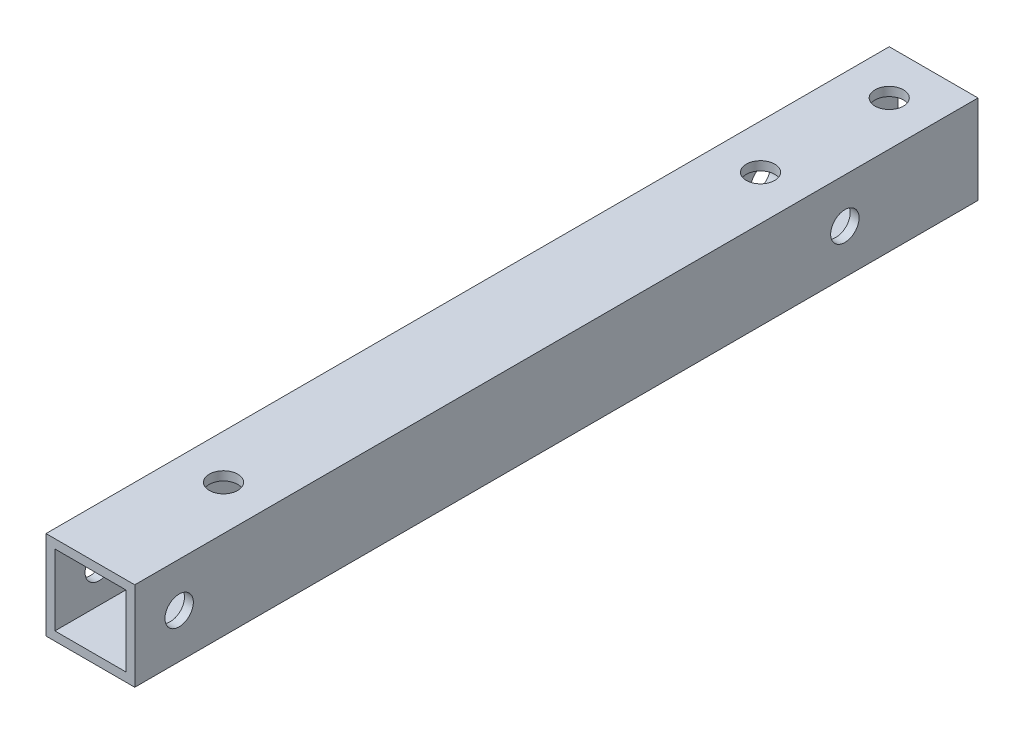
from build123d import *

# Parameters (mm, degrees)
SKETCH_1_W          = 10
SKETCH_1_H          = 10
SKETCH_1_W_2        = 8
SKETCH_1_H_2        = 8
EXTRUDE_1_DEPTH     = 95
SKETCH_2_R          = 1.6
CUT_EXTRUDE_1_DEPTH = 96.655632349
SKETCH_3_R          = 1.6
CUT_EXTRUDE_2_DEPTH = 96.655632349


with BuildPart() as part:
    # ｽｹｯﾁ1 → ﾎﾞｽ - 押し出し1 (new body)
    with BuildSketch(Plane.XY):
        Rectangle(SKETCH_1_W, SKETCH_1_H)
        Rectangle(SKETCH_1_W_2, SKETCH_1_H_2, mode=Mode.SUBTRACT)
    extrude(amount=EXTRUDE_1_DEPTH)

    # ｽｹｯﾁ2 → ｶｯﾄ - 押し出し1 (cut, through all)
    with BuildSketch(Plane(origin=(0, 5, 0), x_dir=(1, 0, 0), z_dir=(0, 1, 0))):
        with Locations(Location((0, -5, 0), (0, 0, 270))):
            Circle(SKETCH_2_R)
        with Locations(Location((0, -80, 0), (0, 0, 270))):
            Circle(SKETCH_2_R)
        with Locations(Location((0, -19.5, 0), (0, 0, 270))):
            Circle(SKETCH_2_R)
    extrude(amount=-CUT_EXTRUDE_1_DEPTH, mode=Mode.SUBTRACT)

    # ｽｹｯﾁ3 → ｶｯﾄ - 押し出し2 (cut, through all)
    with BuildSketch(Plane.ZY.offset(5)):
        with Locations((15, 0)):
            Circle(SKETCH_3_R)
        with Locations((90, 0)):
            Circle(SKETCH_3_R)
    extrude(amount=-CUT_EXTRUDE_2_DEPTH, mode=Mode.SUBTRACT)


solid = part.part
